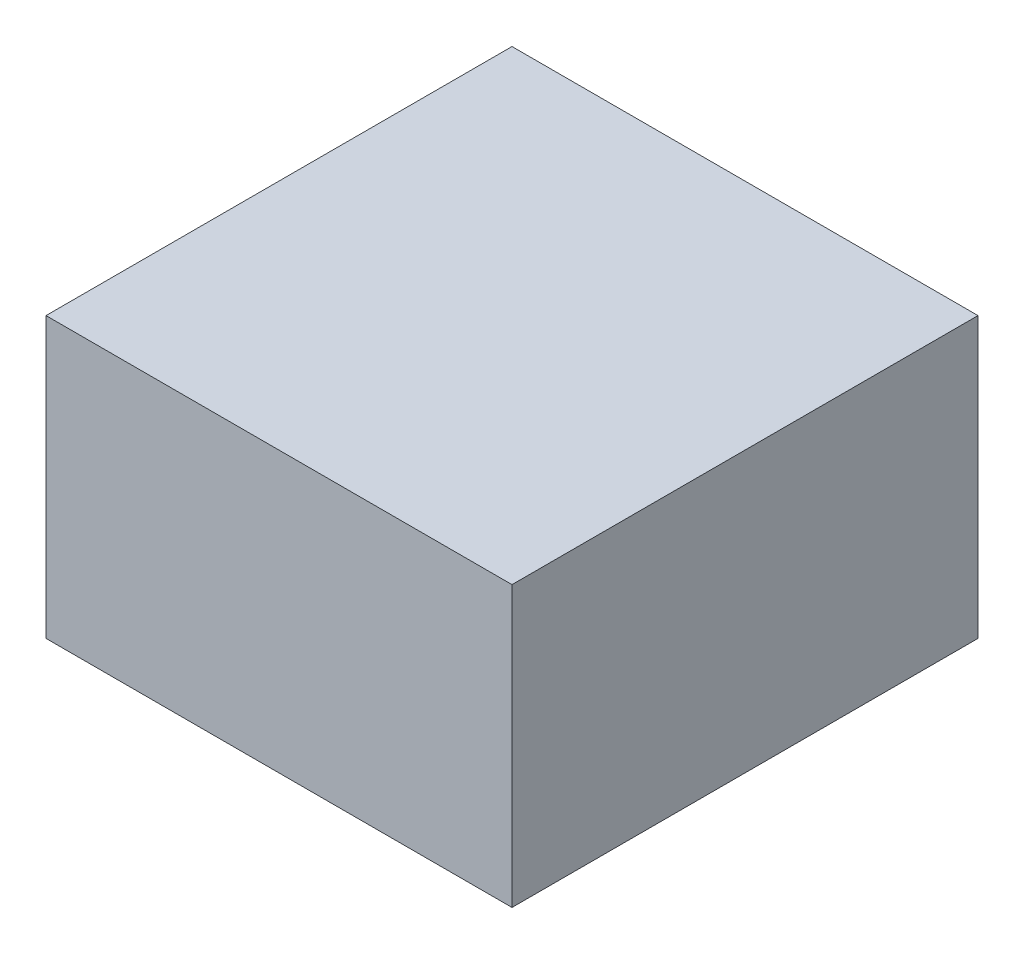
from build123d import *

# Parameters (mm, degrees)
SKETCH1_W           = 31.75
SKETCH1_H           = 31.75
BOSS_EXTRUDE1_DEPTH = 19.05


with BuildPart() as part:
    # Sketch1 → Boss-Extrude1 (new body)
    with BuildSketch(Plane(origin=(0, 0, 0), x_dir=(1, 0, 0), z_dir=(0, 1, 0))):
        with Locations((15.875, 15.875)):
            Rectangle(SKETCH1_W, SKETCH1_H)
    extrude(amount=BOSS_EXTRUDE1_DEPTH)


solid = part.part
